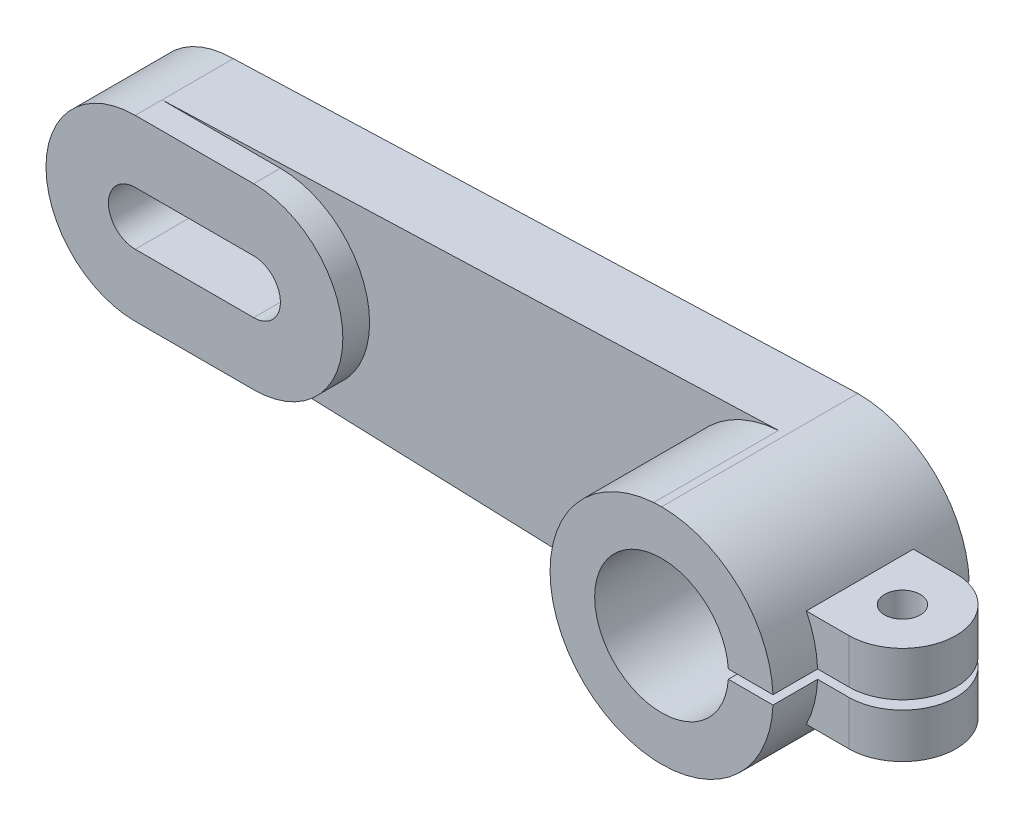
from build123d import *

# Parameters (mm, degrees)
SKICA2_R                 = 15
P_IDAT_VYSUNUT_M1_DEPTH  = 16
P_IDAT_VYSUNUT_M2_DEPTH  = 22
SKICA2_4_R               = 15
P_IDAT_VYSUNUT_M3_DEPTH  = 44
SKICA3_R                 = 4
P_IDAT_VYSUNUT_M4_DEPTH  = 11
SKICA4_W                 = 50
SKICA4_H                 = 2
ODEBRAT_VYSUNUT_M1_DEPTH = 191.832387188


with BuildPart() as part:
    # Skica2 → Přidat vysunutím1 (new body)
    with BuildSketch(Plane.XY):
        with BuildLine():
            ThreePointArc((0, 20), (-20, 0), (0, -20))
            Line((0, -20), (140, -25))
            ThreePointArc((140, -25), (165, 0), (140, 25))
            Line((140, 25), (0, 20))
        make_face()
        with Locations((140, 0)):
            Circle(SKICA2_R, mode=Mode.SUBTRACT)
        with BuildLine():
            Line((26.547310648, -6), (0, -6))
            ThreePointArc((0, -6), (-6, 0), (0, 6))
            Line((0, 6), (26.547310648, 6))
            ThreePointArc((26.547310648, 6), (32.547310648, 0), (26.547310648, -6))
        make_face(mode=Mode.SUBTRACT)
    extrude(amount=P_IDAT_VYSUNUT_M1_DEPTH)

    # Skica2<3> → Přidat vysunutím2 (add)
    with BuildSketch(Plane.XY):
        with BuildLine():
            Line((26.547310648, 20), (0, 20))
            ThreePointArc((0, 20), (-20, 0), (0, -20))
            Line((0, -20), (26.547310648, -20))
            ThreePointArc((26.547310648, -20), (46.547310648, 0), (26.547310648, 20))
        make_face()
        with BuildLine():
            ThreePointArc((0, -6), (-6, 0), (0, 6))
            Line((0, 6), (26.547310648, 6))
            ThreePointArc((26.547310648, 6), (32.547310648, 0), (26.547310648, -6))
            Line((26.547310648, -6), (0, -6))
        make_face(mode=Mode.SUBTRACT)
    extrude(amount=P_IDAT_VYSUNUT_M2_DEPTH)

    # Skica2<4> → Přidat vysunutím3 (add)
    with BuildSketch(Plane.XY):
        with BuildLine():
            Line((140, 25), (138.21656051, 24.936305732))
            ThreePointArc((138.21656051, 24.936305732), (115, 0), (138.21656051, -24.936305732))
            Line((138.21656051, -24.936305732), (140, -25))
            ThreePointArc((140, -25), (157.67766953, -17.67766953), (165, 0))
            ThreePointArc((165, 0), (157.67766953, 17.67766953), (140, 25))
        make_face()
        with Locations((140, 0)):
            Circle(SKICA2_4_R, mode=Mode.SUBTRACT)
    extrude(amount=P_IDAT_VYSUNUT_M3_DEPTH)

    # Skica3 → Přidat vysunutím4 (add, symmetric)
    with BuildSketch(Plane(origin=(0, 0, 0), x_dir=(1, 0, 0), z_dir=(0, 1, 0))):
        with BuildLine():
            Line((172, -10), (156.52015128, -10))
            Line((156.52015128, -10), (156.52015128, -34))
            Line((156.52015128, -34), (172, -34))
            ThreePointArc((172, -34), (184, -22), (172, -10))
        make_face()
        with Locations((172, -22)):
            Circle(SKICA3_R, mode=Mode.SUBTRACT)
    extrude(amount=P_IDAT_VYSUNUT_M4_DEPTH, both=True)

    # Skica4 → Odebrat vysunutím1 (cut, through all)
    with BuildSketch(Plane.XY.offset(44)):
        with Locations((165, 0)):
            Rectangle(SKICA4_W, SKICA4_H)
    extrude(amount=-ODEBRAT_VYSUNUT_M1_DEPTH, mode=Mode.SUBTRACT)


solid = part.part
